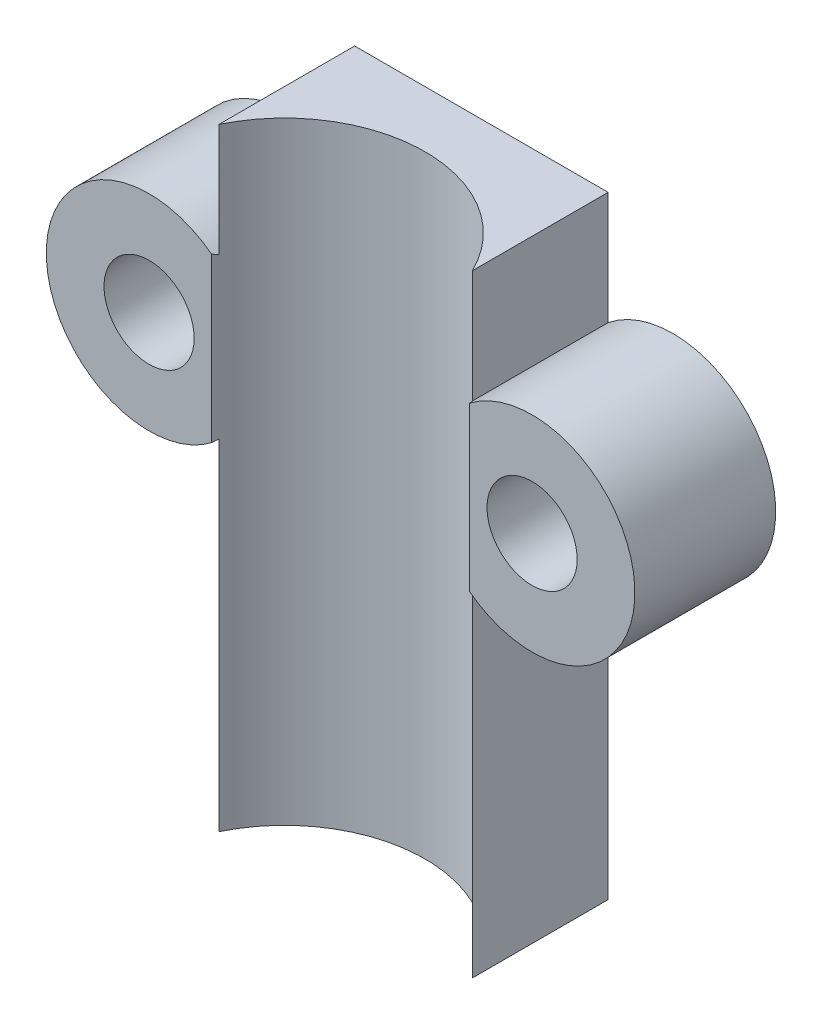
from build123d import *

# Parameters (mm, degrees)
SKETCH1_R           = 1.6
BOSS_EXTRUDE1_DEPTH = 5
SKETCH2_R           = 5
CUT_EXTRUDE1_DEPTH  = 162.695924751


with BuildPart() as part:
    # Sketch1 → Boss-Extrude1 (new body)
    with BuildSketch(Plane.XY):
        with BuildLine():
            Line((-154.198398621, -11.402119157), (-154.198398621, -23.477952613))
            Line((-154.198398621, -23.477952613), (-145.198398621, -23.477952613))
            Line((-145.198398621, -23.477952613), (-145.198398621, -11.402119157))
            ThreePointArc((-145.198398621, -11.402119157), (-139.248398621, -8.567952613), (-145.198398621, -5.733786068))
            Line((-145.198398621, -5.733786068), (-145.198398621, -1.727952613))
            Line((-145.198398621, -1.727952613), (-154.198398621, -1.727952613))
            Line((-154.198398621, -1.727952613), (-154.198398621, -5.733786068))
            ThreePointArc((-154.198398621, -5.733786068), (-160.148398621, -8.567952613), (-154.198398621, -11.402119157))
        make_face()
        with Locations((-156.498398621, -8.567952613)):
            Circle(SKETCH1_R, mode=Mode.SUBTRACT)
        with Locations((-142.898398621, -8.567952613)):
            Circle(SKETCH1_R, mode=Mode.SUBTRACT)
    extrude(amount=BOSS_EXTRUDE1_DEPTH)

    # Sketch2 → Cut-Extrude1 (cut, through all)
    with BuildSketch(Plane(origin=(0, -1.727952613, 0), x_dir=(1, 0, 0), z_dir=(0, 1, 0))):
        with Locations((-149.698398621, -7)):
            Circle(SKETCH2_R)
    extrude(amount=-CUT_EXTRUDE1_DEPTH, mode=Mode.SUBTRACT)


solid = part.part
